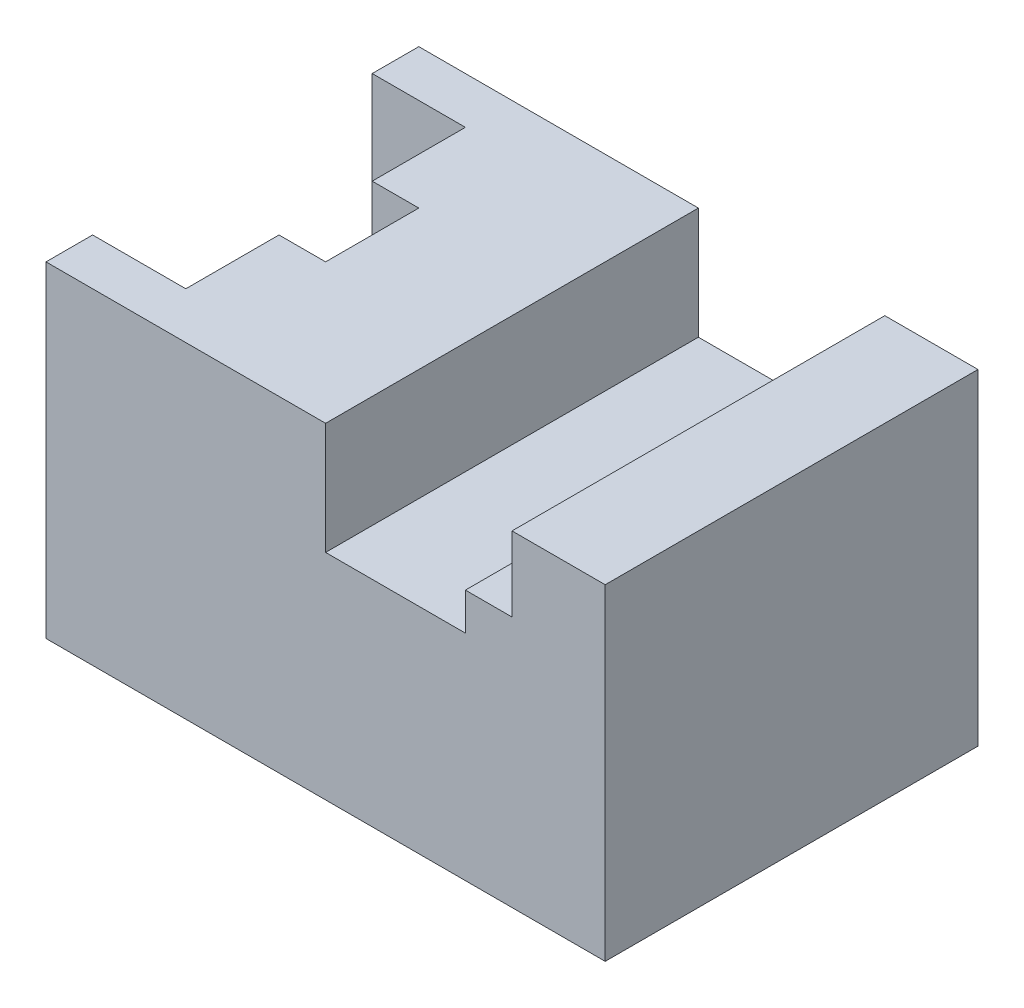
from build123d import *

# Parameters (mm, degrees)
SKETCH_1_W          = 60
SKETCH_1_H          = 35
EXTRUDE_1_DEPTH     = 20
SKETCH_2_W          = 5
SKETCH_2_H          = 10
CUT_EXTRUDE_1_DEPTH = 25
SKETCH_3_W          = 5
SKETCH_3_H          = 8
CUT_EXTRUDE_2_DEPTH = 53.974050251


with BuildPart() as part:
    # Эскиз1 → Бобышка-Вытянуть1 (new, symmetric)
    with BuildSketch(Plane.XY):
        Rectangle(SKETCH_1_W, SKETCH_1_H)
    extrude(amount=EXTRUDE_1_DEPTH, both=True)

    # Эскиз2 → Вырез-Вытянуть1 (cut)
    with BuildSketch(Plane(origin=(0, 17.5, 0), x_dir=(1, 0, 0), z_dir=(0, 1, 0))):
        Polygon((-30, 15), (-30, -15), (-20, -15), (-20, -5), (-20, 5), (-20, 15), align=None)
        with Locations((-17.5, 0)):
            Rectangle(SKETCH_2_W, SKETCH_2_H)
    extrude(amount=-CUT_EXTRUDE_1_DEPTH, mode=Mode.SUBTRACT)

    # Эскиз3 → Вырез-Вытянуть2 (cut, through all)
    with BuildSketch(Plane.XY.offset(20)):
        Polygon((0, 17.5), (0, 5.5), (15, 5.5), (15, 9.5), (15, 17.5), align=None)
        with Locations((17.5, 13.5)):
            Rectangle(SKETCH_3_W, SKETCH_3_H)
    extrude(amount=-CUT_EXTRUDE_2_DEPTH, mode=Mode.SUBTRACT)


solid = part.part
